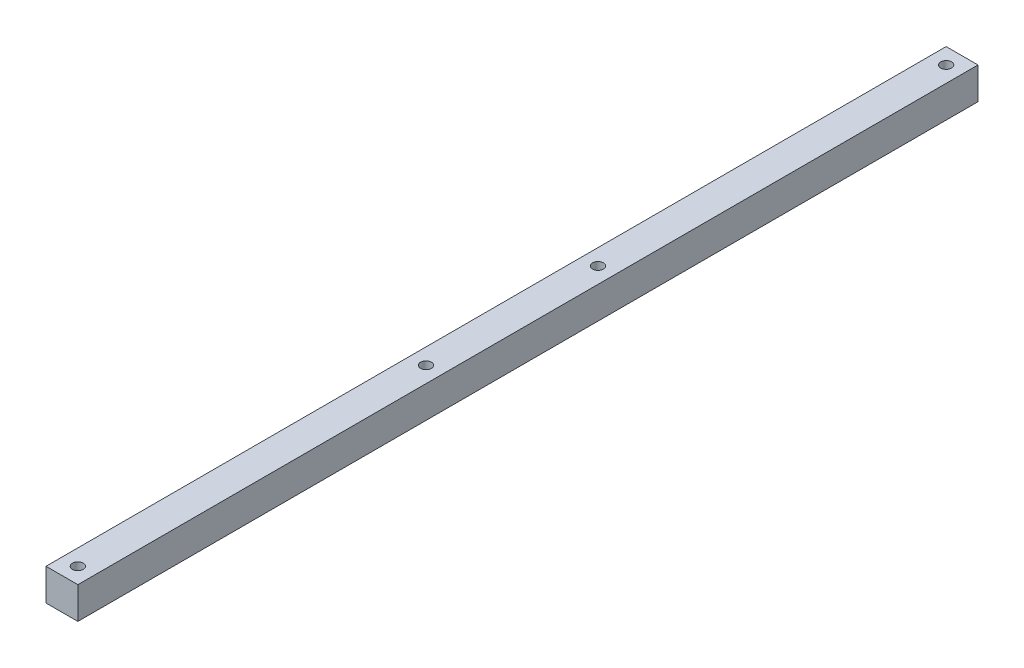
from build123d import *

# Parameters (mm, degrees)
SKETCH1_W           = 5
SKETCH1_H           = 5
BOSS_EXTRUDE1_DEPTH = 141.3
SKETCH3_R           = 0.85
CUT_EXTRUDE2_DEPTH  = 142.41053709


with BuildPart() as part:
    # Sketch1 → Boss-Extrude1 (new body)
    with BuildSketch(Plane.XY):
        Rectangle(SKETCH1_W, SKETCH1_H)
    extrude(amount=BOSS_EXTRUDE1_DEPTH)

    # Sketch3 → Cut-Extrude2 (cut, through all)
    with BuildSketch(Plane.XZ.offset(2.5)):
        with Locations(Location((0, 138.8, 0), (0, 0, 270))):
            Circle(SKETCH3_R)
        with Locations(Location((0, 2.5, 0), (0, 0, 90))):
            Circle(SKETCH3_R)
        with Locations(Location((0, 84.15, 0), (0, 0, 270))):
            Circle(SKETCH3_R)
        with Locations(Location((0, 57.15, 0), (0, 0, 90))):
            Circle(SKETCH3_R)
    extrude(amount=-CUT_EXTRUDE2_DEPTH, mode=Mode.SUBTRACT)


solid = part.part
